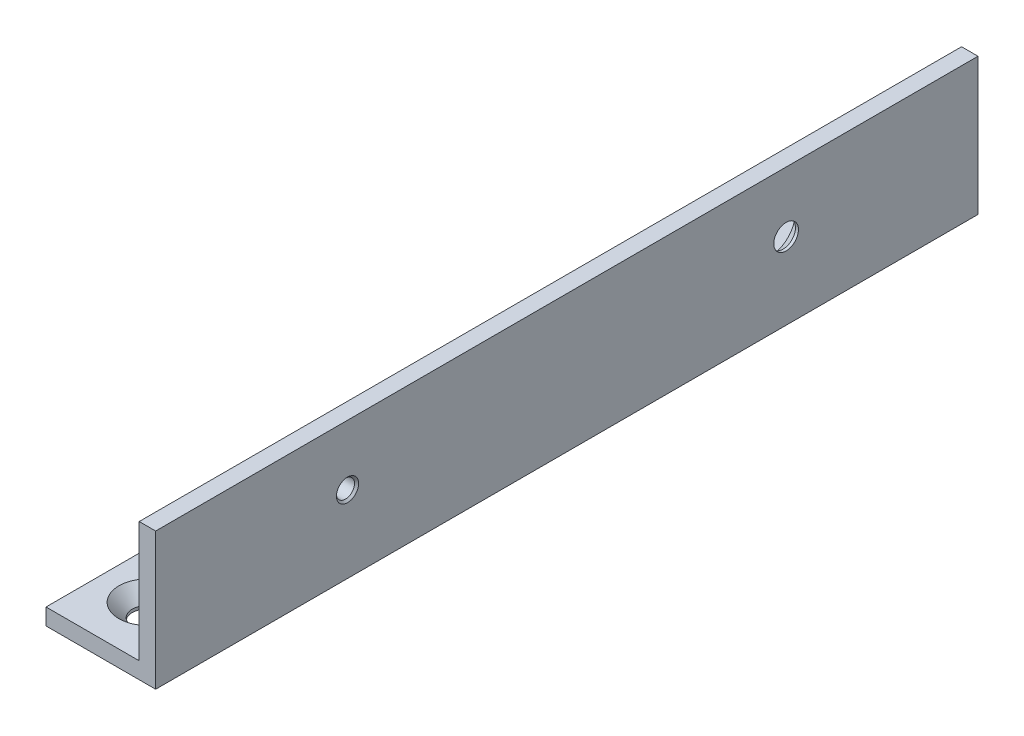
from build123d import *

# Parameters (mm, degrees)
BOSS_EXTRU_1_DEPTH                             = 150
FRAISAGE_POUR_VIS_T_TE_FRAIS_E_M41_D           = 4.5
FRAISAGE_POUR_VIS_T_TE_FRAIS_E_M41_DEPTH       = 25
FRAISAGE_POUR_VIS_T_TE_FRAIS_E_M41_CSINK_D     = 9.4
FRAISAGE_POUR_VIS_T_TE_FRAIS_E_M41_CSINK_ANGLE = 90
FRAISAGE_POUR_VIS_T_TE_FRAIS_E_M41_TIP         = 1.351936393
FRAISAGE_POUR_VIS_T_TE_FRAIS_E_M52_AT_COUNT    = 2
FRAISAGE_POUR_VIS_T_TE_FRAIS_E_M52_AT_PITCH    = 65
FRAISAGE_POUR_VIS_T_TE_FRAIS_E_M52_2_COUNT     = 2
FRAISAGE_POUR_VIS_T_TE_FRAIS_E_M52_2_PITCH     = 65


with BuildPart() as part:
    # Esquisse1 → Boss.-Extru.1 (new body)
    with BuildSketch(Plane.XY):
        Polygon((0, 25), (0, 0), (-20, 0), (-20, 3), (-3, 3), (-3, 25), align=None)
    extrude(amount=BOSS_EXTRU_1_DEPTH)

    # Fraisage pour vis à tête fraisée M41
    with Locations(Plane.ZY.offset(3)):
        with Locations((35, 14)):
            CounterSinkHole(FRAISAGE_POUR_VIS_T_TE_FRAIS_E_M41_D / 2, FRAISAGE_POUR_VIS_T_TE_FRAIS_E_M41_CSINK_D / 2, depth=FRAISAGE_POUR_VIS_T_TE_FRAIS_E_M41_DEPTH, counter_sink_angle=FRAISAGE_POUR_VIS_T_TE_FRAIS_E_M41_CSINK_ANGLE)
            with Locations((0, 0, -(FRAISAGE_POUR_VIS_T_TE_FRAIS_E_M41_DEPTH + FRAISAGE_POUR_VIS_T_TE_FRAIS_E_M41_TIP / 2))):  # 118° drill point
                Cone(0, FRAISAGE_POUR_VIS_T_TE_FRAIS_E_M41_D / 2, FRAISAGE_POUR_VIS_T_TE_FRAIS_E_M41_TIP, mode=Mode.SUBTRACT)

    # Esquisse6 → Trou taraudé M51 (revolve, cut)
    with BuildSketch(Plane(origin=(0, 14, 115), x_dir=(0, 0, -1), z_dir=(0, 1, 0))):
        Polygon((0, 0), (0, 3), (2.025, 3), (1.65, 2.625), (1.65, 0.375), (2.025, 0), align=None)
    revolve(axis=Axis((6.35, 14, 115), (-1, 0, 0)), mode=Mode.SUBTRACT)

    # Esquisse8 → Fraisage pour vis à tête fraisée M52 (revolve, cut)
    with BuildSketch(Plane(origin=(-11.5, 3, 75), x_dir=(0, 0, 1), z_dir=(1, 0, 0))):
        Polygon((0, 0), (0, 3), (2.75, 3), (2.75, 2.45), (5.2, 0), align=None)
    fraisage_pour_vis_t_te_frais_e_m52 = revolve(axis=Axis((-11.5, 9.35, 75), (0, -1, 0)), mode=Mode.SUBTRACT)

    # Fraisage pour vis à tête fraisée M52 at: Fraisage pour vis à tête fraisée M52 ×2
    with Locations(*[(0, 0, i * FRAISAGE_POUR_VIS_T_TE_FRAIS_E_M52_AT_PITCH) for i in range(1, FRAISAGE_POUR_VIS_T_TE_FRAIS_E_M52_AT_COUNT)]):
        add(fraisage_pour_vis_t_te_frais_e_m52, mode=Mode.SUBTRACT)

    # Fraisage pour vis _ t_te frais_e M52 2: Fraisage pour vis à tête fraisée M52 ×2
    with Locations(*[(0, 0, -i * FRAISAGE_POUR_VIS_T_TE_FRAIS_E_M52_2_PITCH) for i in range(1, FRAISAGE_POUR_VIS_T_TE_FRAIS_E_M52_2_COUNT)]):
        add(fraisage_pour_vis_t_te_frais_e_m52, mode=Mode.SUBTRACT)


solid = part.part
